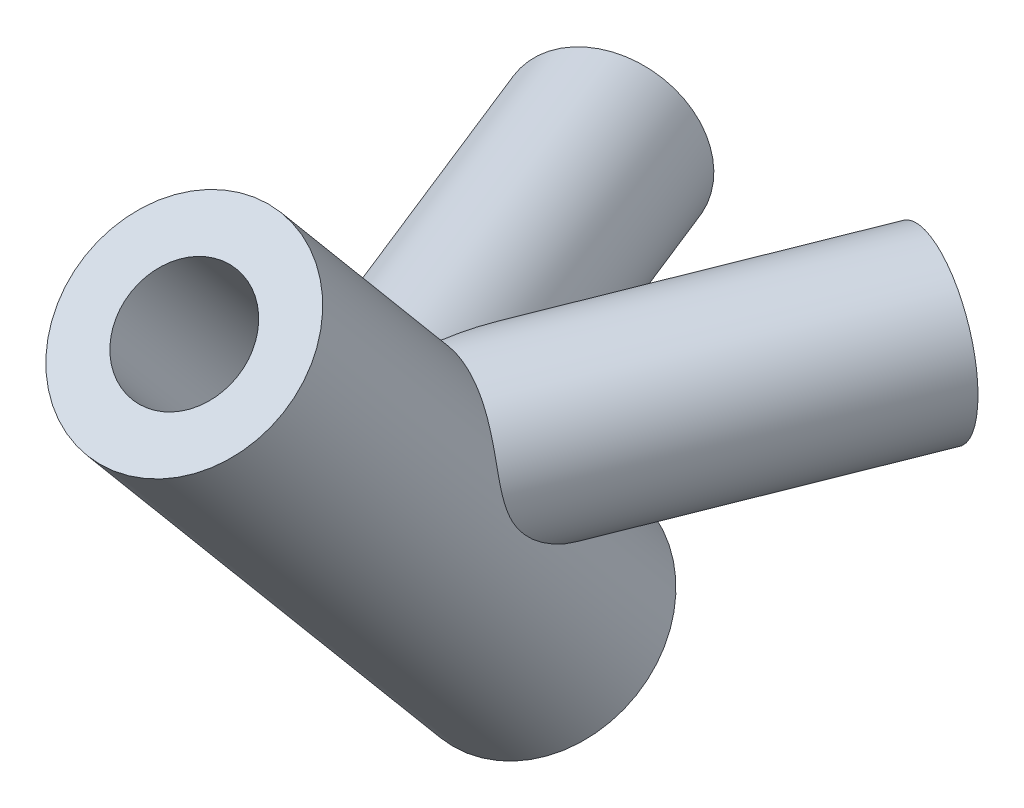
from build123d import *

# Parameters (mm, degrees)
SKETCH1_R           = 5.08
BOSS_EXTRUDE1_DEPTH = 12.7
SKETCH5_R           = 3.81
BOSS_EXTRUDE2_DEPTH = 20.32
SKETCH6_R           = 2.7305
CUT_EXTRUDE1_DEPTH  = 10.16
CUT_EXTRUDE2_REACH  = 34.362
SKETCH7_R           = 2.7305


with BuildPart() as part:
    # Sketch1 → Boss-Extrude1 (new, symmetric)
    with BuildSketch(Plane(origin=(0, 0, 0), x_dir=(1, 0, 0), z_dir=(0, 0.7660444431189771, 0.6427876096865406))):
        Circle(SKETCH1_R)
    extrude(amount=BOSS_EXTRUDE1_DEPTH, both=True)

    # Sketch5 → Boss-Extrude2 (add)
    with BuildSketch(Plane(origin=(0, 0, 0), x_dir=(0, -1, 0), z_dir=(-0.36974675727382683, 0, -0.9291325715340572))):
        Circle(SKETCH5_R)
    boss_extrude2 = extrude(amount=BOSS_EXTRUDE2_DEPTH)

    # Sketch6 → Cut-Extrude1 (cut)
    with BuildSketch(Plane(origin=(-7.513254108, 0, -18.879973854), x_dir=(-0.9291325715340572, 0, 0.36974675727382694), z_dir=(-0.3697467572738269, 0, -0.929132571534057))):
        Circle(SKETCH6_R)
    cut_extrude1 = extrude(amount=-CUT_EXTRUDE1_DEPTH, mode=Mode.SUBTRACT)

    # Mirror1: Boss-Extrude2, Cut-Extrude1 across plane
    add(boss_extrude2.mirror(Plane(origin=(0, 0, 0), x_dir=(0, 0, 1), z_dir=(1, 0, 0))))
    add(cut_extrude1.mirror(Plane(origin=(0, 0, 0), x_dir=(0, 0, 1), z_dir=(1, 0, 0))), mode=Mode.SUBTRACT)

    # Sketch7 → Cut-Extrude2 (cut, up to next)
    with BuildSketch(Plane(origin=(0, -9.728764428, -8.163402643), x_dir=(1, 0, 0), z_dir=(0, -0.7660444431189772, -0.6427876096865405)), mode=Mode.PRIVATE) as cut_extrude2_sk1:
        Circle(SKETCH7_R)
    cut_extrude2_tool1 = extrude(cut_extrude2_sk1.sketch, amount=-CUT_EXTRUDE2_REACH, mode=Mode.PRIVATE) & part.part
    add(cut_extrude2_tool1.solids().sort_by_distance((0, -9.728764, -8.163403))[0], mode=Mode.SUBTRACT)


solid = part.part
